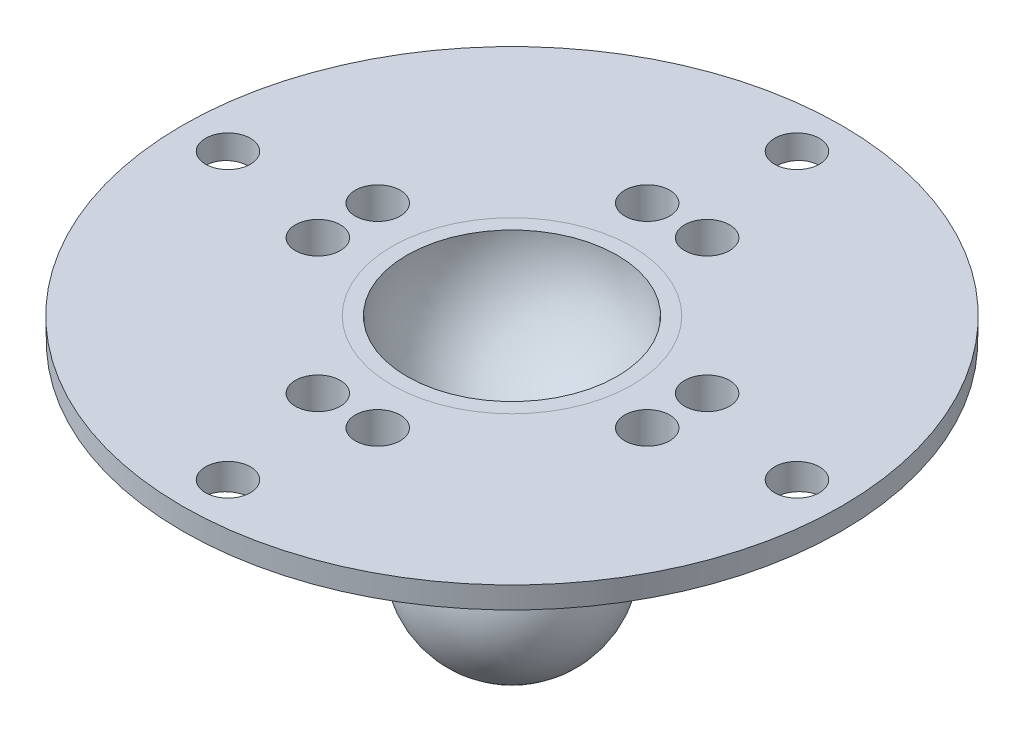
from build123d import *

# Parameters (mm, degrees)
SKETCH2_R          = 0.75
CUT_EXTRUDE1_DEPTH = 13


with BuildPart() as part:
    # Sketch1 → Revolve5 (revolve)
    with BuildSketch(Plane(origin=(0, 0, 0), x_dir=(0, 0, -1), z_dir=(1, 0, 0)), mode=Mode.PRIVATE) as revolve5_sk:
        with BuildLine():
            Line((3.994437549, 3.999999971), (10.994437549, 3.999999971))
            Line((10.994437549, 3.999999971), (10.982067685, 3.267144902))
            Line((10.982067685, 3.267144902), (3.79501258, 2.752747385))
            ThreePointArc((3.79501258, 2.752747385), (2.830168391, 1.178891634), (1.261323062, 0.205921661))
            Line((1.261323062, 0.205921661), (1.262886867, -0.278097135))
            ThreePointArc((1.262886867, -0.278097135), (2.930994437, -3.646307895), (0.00054015, -5.999999519))
            Line((0.00054015, -5.999999519), (0.002641108, -5.499999366))
            ThreePointArc((0.002641108, -5.499999366), (2.501440602, -2.999897942), (0.002437684, -0.499999853))
            Line((0.002437684, -0.499999853), (2.6417e-05, 0.500000595))
            ThreePointArc((2.6417e-05, 0.500000595), (2.471287814, 1.527100509), (3.494437549, 3.999999971))
            Line((3.494437549, 3.999999971), (3.994437549, 3.999999971))
        make_face()
    revolve(revolve5_sk.sketch.rotate(Axis((0, 10.3413497, 0.015216129), (0, -0.9999999999860412, 5.283725131868927e-06)), 180), axis=Axis((0, 10.3413497, 0.015216129), (0, -0.9999999999860412, 5.283725131868927e-06)))

    # Sketch2 → Cut-Extrude1 (cut)
    with BuildSketch(Plane(origin=(0, 4.000058062, -2.1135e-05), x_dir=(1, 0, 0), z_dir=(0, 0.9999999999860413, -5.283725131900164e-06))):
        with Locations(Location((0, 0, 0), (0, 0, 270))):
            Circle(SKETCH2_R)
        with Locations(Location((-9.5, 0, 0), (0, 0, 179.907900006))):
            Circle(SKETCH2_R)
        with Locations(Location((1, -5.5, 0), (0, 0, 135.609553942))):
            Circle(SKETCH2_R)
        with Locations(Location((0, -9.5, 0), (0, 0, 270))):
            Circle(SKETCH2_R)
        with Locations(Location((0, 9.5, 0), (0, 0, 135.6930315))):
            Circle(SKETCH2_R)
        with Locations(Location((9.5, 0, 0), (0, 0, 0.092099994))):
            Circle(SKETCH2_R)
        with Locations(Location((-5.499503477, 1, 0), (0, 0, 135.233931032))):
            Circle(SKETCH2_R)
        with Locations(Location((-5.499503477, -1, 0), (0, 0, 135.40077767))):
            Circle(SKETCH2_R)
        with Locations(Location((-1, -5.5, 0), (0, 0, 135.768707065))):
            Circle(SKETCH2_R)
        with Locations(Location((5.499503477, -1, 0), (0, 0, 135.000437104))):
            Circle(SKETCH2_R)
        with Locations(Location((5.499503477, 1, 0), (0, 0, 135.000437104))):
            Circle(SKETCH2_R)
        with Locations(Location((1, 5.5, 0), (0, 0, 135.000437105))):
            Circle(SKETCH2_R)
        with Locations(Location((-1, 5.5, 0), (0, 0, 135.000437107))):
            Circle(SKETCH2_R)
    extrude(amount=-CUT_EXTRUDE1_DEPTH, mode=Mode.SUBTRACT)


solid = part.part
